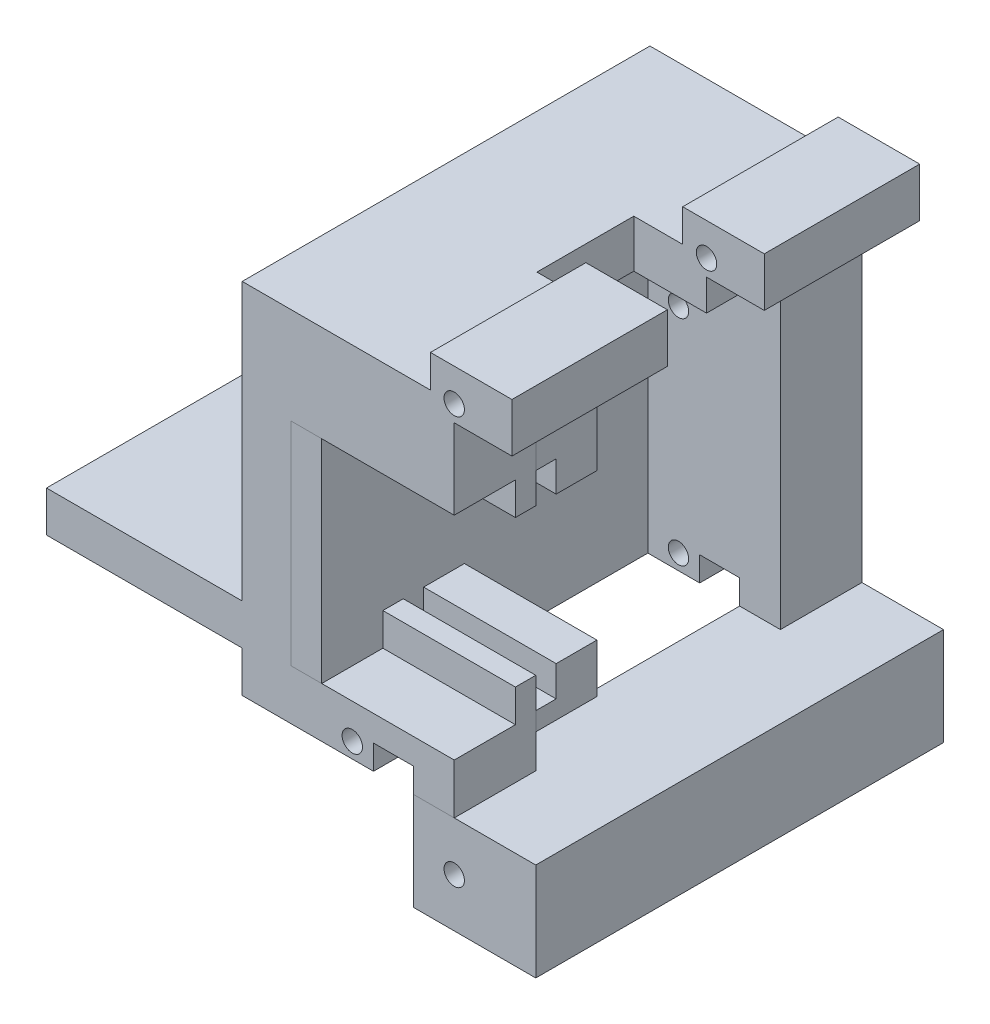
from build123d import *

# Parameters (mm, degrees)
SKETCH8_R                = 1.5875
BOSS_EXTRUDE3_DEPTH      = 101.6
SKETCH40_W               = 25.4
SKETCH40_H               = 38.1
CUT_EXTRUDE24_DEPTH      = 50.8
CUT_EXTRUDE11_DEPTH      = 130.327883255
CUT_EXTRUDE11_DEPTH_BACK = 101.6
SKETCH18_W               = 33.02
SKETCH18_H               = 2.3622
BOSS_EXTRUDE4_DEPTH      = 101.6
CUT_EXTRUDE12_START      = -101.6
SKETCH20_R               = 1.5875
CUT_EXTRUDE12_DEPTH      = 101.6
SKETCH21_W               = 33.02
SKETCH21_H               = 19.05
CUT_EXTRUDE13_DEPTH      = 135.416648809
SKETCH24_W               = 8.993546066
SKETCH24_H               = 19.05
CUT_EXTRUDE15_DEPTH      = 135.416648809
SKETCH38_W               = 15.0876
SKETCH38_H               = 7.635884817
CUT_EXTRUDE21_DEPTH      = 20.32
SKETCH41_W               = 30.48
SKETCH41_H               = 19.05
CUT_EXTRUDE25_DEPTH      = 130.137479387
SKETCH43_W               = 12.7
SKETCH43_H               = 33.02
CUT_EXTRUDE26_DEPTH      = 25.4
SKETCH44_W               = 3.175
SKETCH44_H               = 5.08
BOSS_EXTRUDE5_DEPTH      = 25.4
BOSS_EXTRUDE6_DEPTH      = 25.4
BOSS_EXTRUDE6_2_DEPTH    = 25.4
SKETCH46_R               = 1.5875
BOSS_EXTRUDE7_DEPTH      = 63.5
CUT_EXTRUDE29_DEPTH      = 105.670466108
CUT_EXTRUDE29_DEPTH_BACK = 12.7
SKETCH49_W               = 6.223
SKETCH49_H               = 3.81
CUT_EXTRUDE31_DEPTH      = 12.7
SKETCH50_W               = 11.326453934
SKETCH50_H               = 15.0876
CUT_EXTRUDE33_DEPTH      = 4.8768
BOSS_EXTRUDE8_DEPTH      = 4.7625


with BuildPart() as part:
    # Sketch8 → Boss-Extrude3 (new body)
    with BuildSketch(Plane.XY):
        Polygon((0, 0), (0, 48.6918), (-33.02, 48.6918), (-33.02, 5.588), (-63.5, 5.588), (-63.5, -0.762), (-33.02, -0.762), (-33.02, -9.525), (-9.525, -9.525), (0, -9.525), align=None)
        with Locations((-15.875, 28.5877)):
            Circle(SKETCH8_R, mode=Mode.SUBTRACT)
        with Locations((-15.875, -4.7625)):
            Circle(SKETCH8_R, mode=Mode.SUBTRACT)
    extrude(amount=BOSS_EXTRUDE3_DEPTH)

    # Sketch40 → Cut-Extrude24 (cut)
    with BuildSketch(Plane.XZ.offset(9.525)):
        with Locations((-12.7, 50.8)):
            Rectangle(SKETCH40_W, SKETCH40_H)
    extrude(amount=-CUT_EXTRUDE24_DEPTH, mode=Mode.SUBTRACT)

    # Sketch18 → Cut-Extrude11 (cut, two sides: drawn at the far end of the back side and taken through both)
    with BuildSketch(Plane.XY.offset(101.6).offset(-CUT_EXTRUDE11_DEPTH_BACK)):
        with Locations((-16.51, -8.3439)):
            Rectangle(SKETCH18_W, SKETCH18_H)
    extrude(amount=CUT_EXTRUDE11_DEPTH + CUT_EXTRUDE11_DEPTH_BACK, mode=Mode.SUBTRACT)

    # Sketch19 → Boss-Extrude4 (add)
    with BuildSketch(Plane(origin=(0, 0, 0), x_dir=(-1, 0, 0), z_dir=(0, 0, -1))):
        with BuildLine():
            Line((1.5875, 48.6918), (3.706453934, 48.6918))
            Line((3.706453934, 48.6918), (3.706453934, 53.7718))
            Line((3.706453934, 53.7718), (-8.993546066, 53.7718))
            Line((-8.993546066, 53.7718), (-8.993546066, 46.135915183))
            Line((-8.993546066, 46.135915183), (0, 46.135915183))
            Line((0, 46.135915183), (0, 47.1043))
            ThreePointArc((0, 47.1043), (-1.122532015, 49.814332015), (1.5875, 48.6918))
        make_face()
    extrude(amount=-BOSS_EXTRUDE4_DEPTH)

    # Sketch20 → Cut-Extrude12 (cut)
    with BuildSketch(Plane.XY.offset(101.6).offset(CUT_EXTRUDE12_START)):
        with Locations(Location((0, 48.6918, 0), (0, 0, 180))):
            Circle(SKETCH20_R)
    extrude(amount=CUT_EXTRUDE12_DEPTH, mode=Mode.SUBTRACT)

    # Sketch21 → Cut-Extrude13 (cut, through all)
    with BuildSketch(Plane.XZ.offset(7.1628)):
        with Locations((-16.51, 92.075)):
            Rectangle(SKETCH21_W, SKETCH21_H)
        with Locations((-16.51, 9.525)):
            Rectangle(SKETCH21_W, SKETCH21_H)
    extrude(amount=-CUT_EXTRUDE13_DEPTH, mode=Mode.SUBTRACT)

    # Sketch24 → Cut-Extrude15 (cut, through all)
    with BuildSketch(Plane(origin=(0, 53.7718, 0), x_dir=(1, 0, 0), z_dir=(0, 1, 0))):
        with Locations((4.496773033, -92.075)):
            Rectangle(SKETCH24_W, SKETCH24_H)
        with Locations((4.496773033, -9.525)):
            Rectangle(SKETCH24_W, SKETCH24_H)
    extrude(amount=-CUT_EXTRUDE15_DEPTH, mode=Mode.SUBTRACT)

    # Sketch38 → Cut-Extrude21 (cut)
    with BuildSketch(Plane(origin=(8.993546066, 0, 0), x_dir=(0, 0, -1), z_dir=(1, 0, 0))):
        with Locations((-50.8, 49.953857592)):
            Rectangle(SKETCH38_W, SKETCH38_H)
    extrude(amount=-CUT_EXTRUDE21_DEPTH, mode=Mode.SUBTRACT)

    # Sketch41 → Cut-Extrude25 (cut, through all)
    with BuildSketch(Plane(origin=(0, 5.588, 0), x_dir=(1, 0, 0), z_dir=(0, 1, 0))):
        with Locations((-48.26, -9.525)):
            Rectangle(SKETCH41_W, SKETCH41_H)
        with Locations((-48.26, -92.075)):
            Rectangle(SKETCH41_W, SKETCH41_H)
    extrude(amount=-CUT_EXTRUDE25_DEPTH, mode=Mode.SUBTRACT)

    # Sketch43 → Cut-Extrude26 (cut)
    with BuildSketch(Plane(origin=(0, 0, 0), x_dir=(0, 0, -1), z_dir=(1, 0, 0))):
        with Locations((-76.2, 17.1577)):
            Rectangle(SKETCH43_W, SKETCH43_H)
    extrude(amount=-CUT_EXTRUDE26_DEPTH, mode=Mode.SUBTRACT)

    # Sketch44 → Boss-Extrude5 (add)
    with BuildSketch(Plane(origin=(-25.4, 0, 0), x_dir=(0, 0, -1), z_dir=(1, 0, 0))):
        with Locations((-71.4375, 31.1277)):
            Rectangle(SKETCH44_W, SKETCH44_H)
        with Locations((-71.4375, 3.1877)):
            Rectangle(SKETCH44_W, SKETCH44_H)
    extrude(amount=BOSS_EXTRUDE5_DEPTH)

    # Sketch48 → Cut-Extrude29 (cut, two sides: drawn at the far end of the back side and taken through both)
    with BuildSketch(Plane.XY.offset(82.55).offset(-CUT_EXTRUDE29_DEPTH_BACK)):
        Polygon((-12.573, -184.245390082), (-12.573, -7.1628), (-12.573, -3.346799078), (-6.35, -3.346799078), (-6.35, -7.1628), (-6.35, -184.245390082), (-6.35, -538.410570247), (-12.573, -538.410570247), align=None)
    extrude(amount=CUT_EXTRUDE29_DEPTH + CUT_EXTRUDE29_DEPTH_BACK, mode=Mode.SUBTRACT)

    # Sketch49 → Cut-Extrude31 (cut)
    with BuildSketch(Plane(origin=(0, 0, 19.05), x_dir=(-1, 0, 0), z_dir=(0, 0, -1))):
        with Locations((9.4615, -5.2578)):
            Rectangle(SKETCH49_W, SKETCH49_H)
    extrude(amount=-CUT_EXTRUDE31_DEPTH, mode=Mode.SUBTRACT)

    # Sketch50 → Cut-Extrude33 (cut)
    with BuildSketch(Plane(origin=(0, 46.135915183, 0), x_dir=(1, 0, 0), z_dir=(0, 1, 0))):
        with Locations((-5.663226967, -50.8)):
            Rectangle(SKETCH50_W, SKETCH50_H)
    extrude(amount=-CUT_EXTRUDE33_DEPTH, mode=Mode.SUBTRACT)


with BuildPart() as body_2:
    # Sketch45 → Boss-Extrude6 (new body)
    with BuildSketch(Plane(origin=(-25.4, 0, 0), x_dir=(0, 0, -1), z_dir=(1, 0, 0))):
        Polygon((-60.325, -1.905), (-60.325, 5.715), (-66.675, 5.715), (-66.675, 0.9525), (-69.85, 0.9525), (-69.85, -1.905), align=None)
    extrude(amount=BOSS_EXTRUDE6_DEPTH)


with BuildPart() as body_3:
    # Sketch45 → Boss-Extrude6 2 (new body)
    with BuildSketch(Plane(origin=(-25.4, 0, 0), x_dir=(0, 0, -1), z_dir=(1, 0, 0))):
        Polygon((-60.325, 41.275), (-69.85, 41.275), (-69.85, 33.3375), (-66.675, 33.3375), (-66.675, 28.575), (-60.325, 28.575), align=None)
    extrude(amount=BOSS_EXTRUDE6_2_DEPTH)


with BuildPart() as body_4:
    # Sketch46 → Boss-Extrude7 (new body)
    with BuildSketch(Plane.XY.offset(82.55)):
        Polygon((12.7, -7.1628), (0, -7.1628), (-6.35, -7.1628), (-6.35, -22.4028), (12.7, -22.4028), align=None)
        with Locations((0, -14.8082)):
            Circle(SKETCH46_R, mode=Mode.SUBTRACT)
    extrude(amount=-BOSS_EXTRUDE7_DEPTH)


with BuildPart() as body_5:
    # Sketch52 → Boss-Extrude8 (new body)
    with BuildSketch(Plane(origin=(-25.4, 0, 0), x_dir=(0, 0, -1), z_dir=(1, 0, 0))):
        Polygon((-82.55, 33.6677), (-73.025, 33.6677), (-73.025, 28.5877), (-69.85, 28.5877), (-69.85, 33.3375), (-66.675, 33.3375), (-66.675, 28.5877), (-60.325, 28.575), (-60.325, 41.275), (-31.75, 41.275), (-31.75, -7.1628), (-69.85, -7.1628), (-69.85, -1.905), (-60.325, -1.905), (-60.325, 5.715), (-66.675, 5.715), (-66.675, 0.9525), (-69.85, 0.9525), (-69.85, 5.7277), (-73.025, 5.7277), (-73.025, 0.6477), (-82.55, 0.6477), align=None)
    extrude(amount=BOSS_EXTRUDE8_DEPTH)


solid = Compound([part.part, body_2.part, body_3.part, body_4.part, body_5.part])
